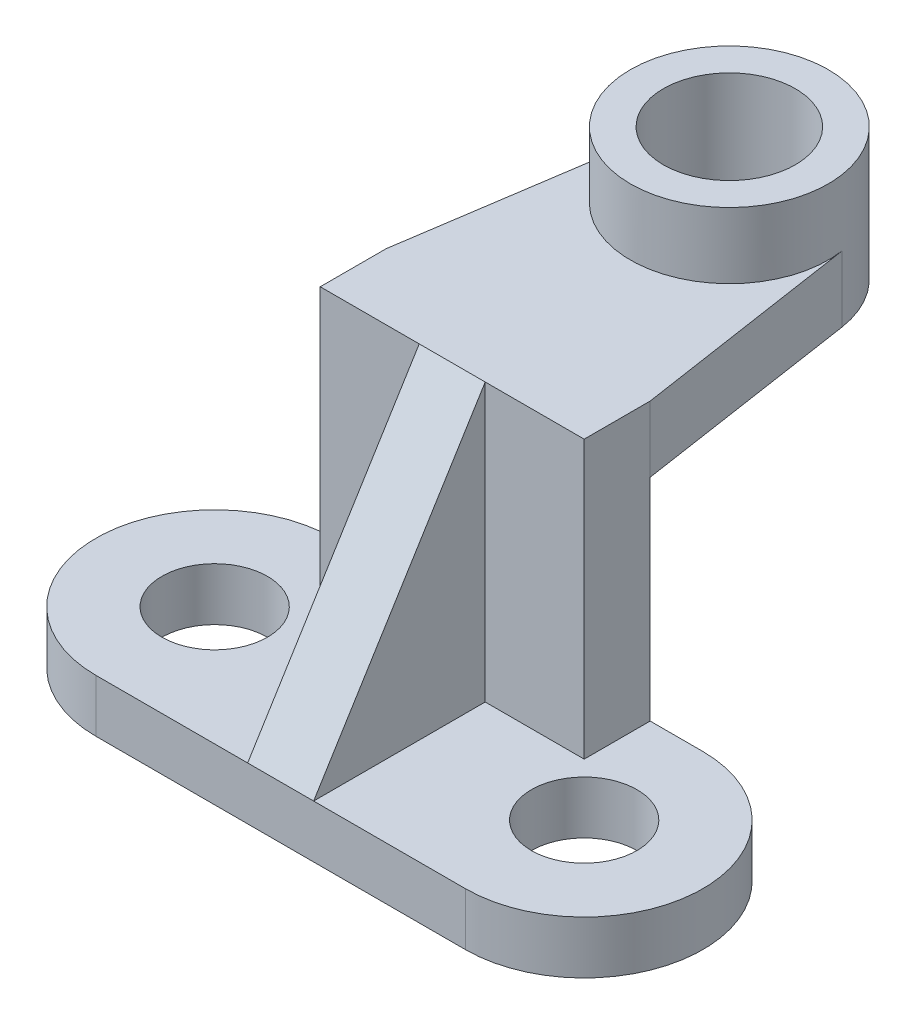
from build123d import *

# Parameters (mm, degrees)
SKETCH1_R           = 8
BOSS_EXTRUDE1_DEPTH = 4
SKETCH2_W           = 40
SKETCH2_H           = 10
BOSS_EXTRUDE2_DEPTH = 32
SKETCH3_R           = 15
SKETCH3_R_2         = 10
BOSS_EXTRUDE3_DEPTH = 10
BOSS_EXTRUDE4_DEPTH = 10
RIB6_REACH          = 99.35
SKETCH5_WALL_W      = 246.096125016
SKETCH5_WALL_H      = 10


with BuildPart() as part:
    # Sketch1 → Boss-Extrude1 (new, symmetric)
    with BuildSketch(Plane(origin=(0, 0, 0), x_dir=(1, 0, 0), z_dir=(0, 1, 0))):
        with BuildLine():
            Line((-28, 18), (28, 18))
            ThreePointArc((28, 18), (46, 0), (28, -18))
            Line((28, -18), (-28, -18))
            ThreePointArc((-28, -18), (-46, 0), (-28, 18))
        make_face()
        with Locations(Location((-28, 0, 0), (0, 0, 270))):
            Circle(SKETCH1_R, mode=Mode.SUBTRACT)
        with Locations(Location((28, 0, 0), (0, 0, 270))):
            Circle(SKETCH1_R, mode=Mode.SUBTRACT)
    extrude(amount=BOSS_EXTRUDE1_DEPTH, both=True)

    # Sketch2 → Boss-Extrude2 (add)
    with BuildSketch(Plane(origin=(0, 4, 0), x_dir=(1, 0, 0), z_dir=(0, 1, 0))):
        with Locations((0, 13)):
            Rectangle(SKETCH2_W, SKETCH2_H)
    extrude(amount=BOSS_EXTRUDE2_DEPTH)



with BuildPart() as body_2:
    # Sketch3 → Boss-Extrude3 (new, symmetric)
    with BuildSketch(Plane(origin=(0, 46, 0), x_dir=(1, 0, 0), z_dir=(0, 1, 0))):
        with Locations(Location((0, 50, 0), (0, 0, 270))):
            Circle(SKETCH3_R)
        with Locations(Location((0, 50, 0), (0, 0, 270))):
            Circle(SKETCH3_R_2, mode=Mode.SUBTRACT)
    extrude(amount=BOSS_EXTRUDE3_DEPTH, both=True)


with BuildPart() as part_1:
    add(part.part)

    add(body_2.part)  # Boss-Extrude4 merges body 2
    # Sketch4 → Boss-Extrude4 (add)
    with BuildSketch(Plane(origin=(0, 46, 0), x_dir=(1, 0, 0), z_dir=(0, 1, 0))):
        with BuildLine():
            Line((20, 8), (20, 18))
            Line((20, 18), (14.831993052, 52.238745657))
            ThreePointArc((14.831993052, 52.238745657), (0, 35), (-14.831993052, 52.238745657))
            Line((-14.831993052, 52.238745657), (-20, 18))
            Line((-20, 18), (-20, 8))
            Line((-20, 8), (20, 8))
        make_face()
    extrude(amount=-BOSS_EXTRUDE4_DEPTH)

    # Sketch5 wall → Rib6 (add, up to next)
    with BuildSketch(Plane(origin=(0, 25, 5), x_dir=(0, -0.850265146688, 0.526354614616), z_dir=(0, -0.526354614616, -0.850265146688)), mode=Mode.PRIVATE) as rib6_sk1:
        Rectangle(SKETCH5_WALL_W, SKETCH5_WALL_H)
    rib6_tool1 = extrude(rib6_sk1.sketch, amount=RIB6_REACH, mode=Mode.PRIVATE) - part_1.part
    add(rib6_tool1.solids().sort_by_distance((0, 25, 5))[0])


solid = part_1.part
